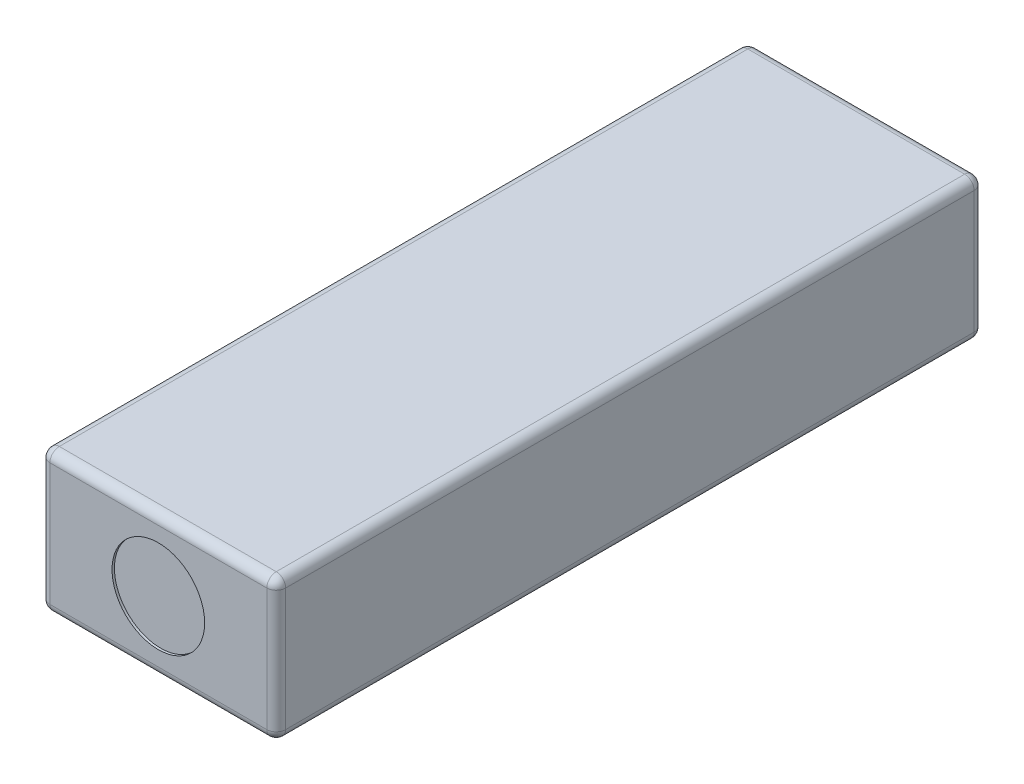
from build123d import *

# Parameters (mm, degrees)
SKETCH2_W           = 50
SKETCH2_H           = 150
BOSS_EXTRUDE1_DEPTH = 30
FILLET1_R           = 2
SKETCH3_R           = 9.81775282
CUT_EXTRUDE1_DEPTH  = 0.5


with BuildPart() as part:
    # Sketch2 → Boss-Extrude1 (new body)
    with BuildSketch(Plane(origin=(0, 0, 0), x_dir=(1, 0, 0), z_dir=(0, 1, 0))):
        Rectangle(SKETCH2_W, SKETCH2_H)
    extrude(amount=BOSS_EXTRUDE1_DEPTH)

    # Fillet1
    fillet1_edges = [part.edges().sort_by_distance(p)[0] for p in [
        (-25, 30, 0),
        (0, 30, 75),
        (25, 30, 0),
        (0, 0, 75),
        (-25, 0, 0),
        (0, 0, -75),
        (25, 0, 0),
        (25, 15, 75),
        (-25, 15, 75),
        (-25, 15, -75),
        (25, 15, -75),
        (0, 30, -75),
    ]]
    fillet(fillet1_edges, radius=FILLET1_R)

    # Sketch3 → Cut-Extrude1 (cut)
    with BuildSketch(Plane.XY.offset(75)):
        with Locations((0, 15)):
            Circle(SKETCH3_R)
    extrude(amount=-CUT_EXTRUDE1_DEPTH, mode=Mode.SUBTRACT)


solid = part.part
